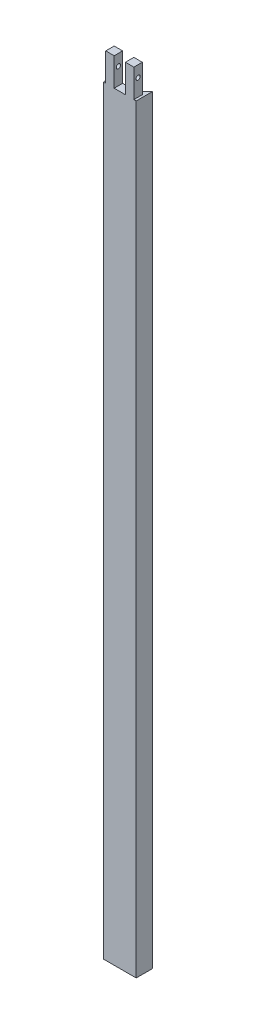
from build123d import *

# Parameters (mm, degrees)
SKETCH2_W           = 6
SKETCH2_H           = 270
BOSS_EXTRUDE1_DEPTH = 3
BOSS_EXTRUDE2_DEPTH = 270
SKETCH5_W           = 3
SKETCH5_H           = 3
BOSS_EXTRUDE3_DEPTH = 10
SKETCH6_R           = 0.75
CUT_EXTRUDE1_DEPTH  = 40


with BuildPart() as part:
    # Sketch2 → Boss-Extrude1 (new body)
    with BuildSketch(Plane.XY):
        with Locations((-3, -135)):
            Rectangle(SKETCH2_W, SKETCH2_H)
    extrude(amount=BOSS_EXTRUDE1_DEPTH)

    # Sketch4 → Boss-Extrude2 (add)
    with BuildSketch(Plane(origin=(0, -270, 0), x_dir=(-1, 0, 0), z_dir=(0, -1, 0))):
        Polygon((0, 0), (-2.828427125, 2.828427125), (-2.828427125, -3), (0, -3), align=None)
        Polygon((8.828427125, -3), (6, -3), (6, 0), (8.828427125, 2.828427125), align=None)
    extrude(amount=-BOSS_EXTRUDE2_DEPTH)

    # Sketch5 → Boss-Extrude3 (add)
    with BuildSketch(Plane(origin=(0, 0, 0), x_dir=(1, 0, 0), z_dir=(0, 1, 0))):
        with Locations((-6.5, -1.5)):
            Rectangle(SKETCH5_W, SKETCH5_H)
        with Locations((0.5, -1.5)):
            Rectangle(SKETCH5_W, SKETCH5_H)
    extrude(amount=BOSS_EXTRUDE3_DEPTH)

    # Sketch6 → Cut-Extrude1 (cut)
    with BuildSketch(Plane(origin=(2, 0, 0), x_dir=(0, 0, -1), z_dir=(1, 0, 0))):
        with Locations((-1.5, 6)):
            Circle(SKETCH6_R)
    extrude(amount=-CUT_EXTRUDE1_DEPTH, mode=Mode.SUBTRACT)


solid = part.part
